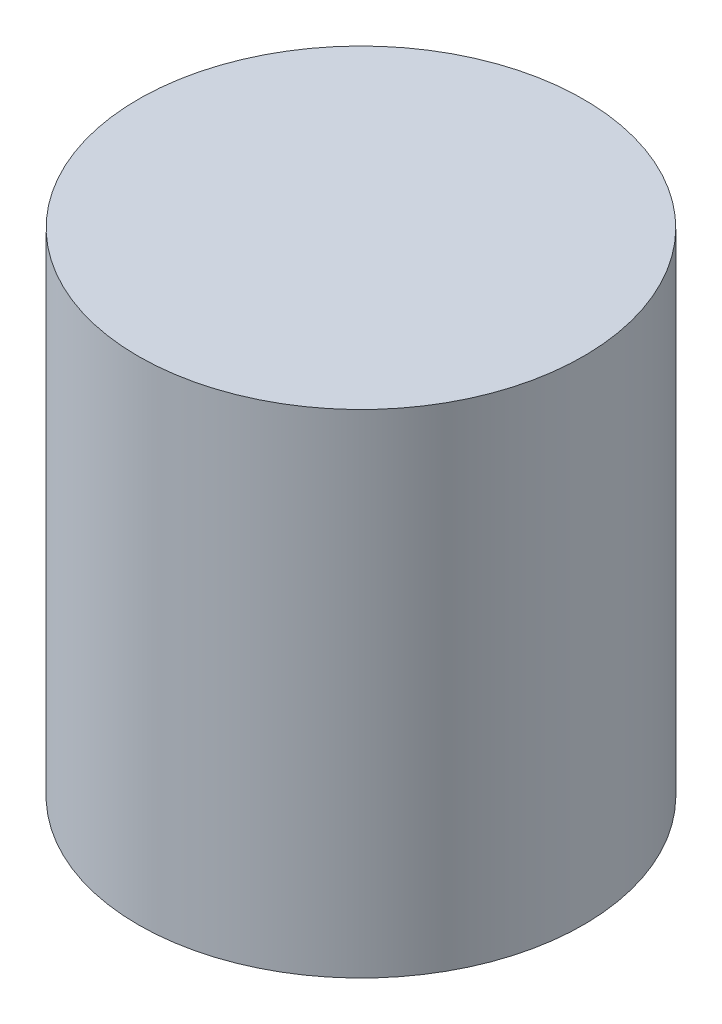
from build123d import *

# Parameters (mm, degrees)
SKETCH1_R           = 80.391
BOSS_EXTRUDE1_DEPTH = 177.8


with BuildPart() as part:
    # Sketch1 → Boss-Extrude1 (new body)
    with BuildSketch(Plane(origin=(0, 0, 0), x_dir=(1, 0, 0), z_dir=(0, 1, 0))):
        with Locations(Location((0, 0, 0), (0, 0, 270))):
            Circle(SKETCH1_R)
    extrude(amount=BOSS_EXTRUDE1_DEPTH)


solid = part.part
